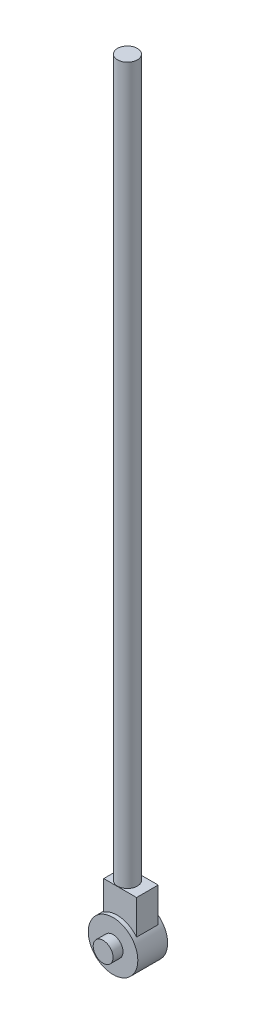
from build123d import *

# Parameters (mm, degrees)
SKETCH1_R                = 2.49
BOSS_EXTRUDE1_DEPTH      = 3
BOSS_EXTRUDE2_DEPTH      = 1
BOSS_EXTRUDE2_DEPTH_BACK = 4
SKETCH2_R                = 1
SKETCH3_W                = 3.303783413
SKETCH3_H                = 2.177091536
BOSS_EXTRUDE3_DEPTH      = 5
SKETCH4_R                = 1
BOSS_EXTRUDE4_DEPTH      = 72


with BuildPart() as part:
    # Sketch1 → Boss-Extrude1 (new body)
    with BuildSketch(Plane.XY):
        Circle(SKETCH1_R)
    extrude(amount=BOSS_EXTRUDE1_DEPTH)

    # Sketch2 → Boss-Extrude2 (add, two sides: drawn at the far end of the back side and taken through both)
    with BuildSketch(Plane.XY.offset(3).offset(-BOSS_EXTRUDE2_DEPTH_BACK)):
        Circle(SKETCH2_R)
    extrude(amount=BOSS_EXTRUDE2_DEPTH + BOSS_EXTRUDE2_DEPTH_BACK)

    # Sketch3 → Boss-Extrude3 (add)
    with BuildSketch(Plane(origin=(0, 0, 0), x_dir=(1, 0, 0), z_dir=(0, 1, 0))):
        with Locations((0.300293678, -1.5)):
            Rectangle(SKETCH3_W, SKETCH3_H)
    extrude(amount=BOSS_EXTRUDE3_DEPTH)

    # Sketch4 → Boss-Extrude4 (add)
    with BuildSketch(Plane(origin=(0, 5, 0), x_dir=(1, 0, 0), z_dir=(0, 1, 0))):
        with Locations(Location((0, -1.555640041, 0), (0, 0, 270))):
            Circle(SKETCH4_R)
    extrude(amount=BOSS_EXTRUDE4_DEPTH)


solid = part.part
